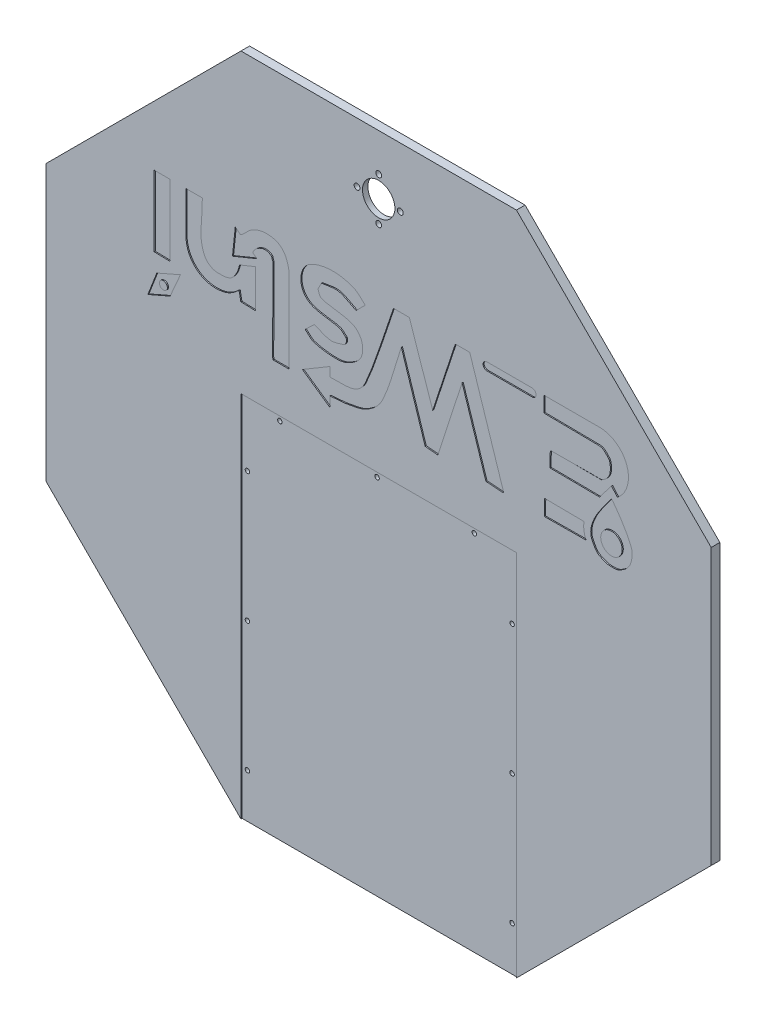
from build123d import *

# Parameters (mm, degrees)
BOSS_EXTRUDE1_DEPTH     = 8
SKETCH3_R               = 25
CUT_EXTRUDE1_DEPTH      = 3
SKETCH4_R               = 2.70323892
CUT_EXTRUDE2_DEPTH      = 192
SKETCH5_R               = 15
CUT_EXTRUDE3_DEPTH      = 192
ESQUISSE2_W             = 255
ESQUISSE2_H             = 341
ENL_V_MAT_EXTRU_2_DEPTH = 1
ESQUISSE5_R             = 3.714022147
ESQUISSE5_R_2           = 9.95215408
ENL_V_MAT_EXTRU_4_DEPTH = 1
ESQUISSE8_R             = 2.05
ENL_V_MAT_EXTRU_5_DEPTH = 20


with BuildPart() as part:
    # Sketch1 → Boss-Extrude1 (new body)
    with BuildSketch(Plane.XY):
        Polygon((307.812229203, -127.5), (307.812229203, 127.5), (127.5, 307.812229203), (-127.5, 307.812229203), (-307.812229203, 127.5), (-307.812229203, -127.5), (-127.5, -307.812229203), (127.5, -307.812229203), align=None)
    extrude(amount=BOSS_EXTRUDE1_DEPTH)

    # Sketch3 → Cut-Extrude1 (cut)
    with BuildSketch(Plane(origin=(0, 0, 0), x_dir=(-1, 0, 0), z_dir=(0, 0, -1))):
        with Locations((0.000533906, 252.812229203)):
            Circle(SKETCH3_R)
    extrude(amount=-CUT_EXTRUDE1_DEPTH, mode=Mode.SUBTRACT)

    # Sketch4 → Cut-Extrude2 (cut)
    with BuildSketch(Plane(origin=(0, 0, 3), x_dir=(-1, 0, 0), z_dir=(0, 0, -1))):
        with Locations((0.000533906, 272.812229203)):
            Circle(SKETCH4_R)
        with Locations((20.000533906, 252.812229203)):
            Circle(SKETCH4_R)
        with Locations((0.000533906, 232.812229203)):
            Circle(SKETCH4_R)
        with Locations((-19.999466094, 252.812229203)):
            Circle(SKETCH4_R)
    extrude(amount=-CUT_EXTRUDE2_DEPTH, mode=Mode.SUBTRACT)

    # Sketch5 → Cut-Extrude3 (cut)
    with BuildSketch(Plane(origin=(0, 0, 3), x_dir=(-1, 0, 0), z_dir=(0, 0, -1))):
        with Locations((0.000533906, 252.812229203)):
            Circle(SKETCH5_R)
    extrude(amount=-CUT_EXTRUDE3_DEPTH, mode=Mode.SUBTRACT)

    # Esquisse2 → Enlèv. mat.-Extru.2 (cut)
    with BuildSketch(Plane.XY.offset(8)):
        with Locations((0, -137.312229203)):
            Rectangle(ESQUISSE2_W, ESQUISSE2_H)
    extrude(amount=-ENL_V_MAT_EXTRU_2_DEPTH, mode=Mode.SUBTRACT)

    # Esquisse5 → Enlèv. mat.-Extru.4 (cut)
    # profile 1 of 10: a face of its own
    with BuildSketch(Plane.XY.offset(8)):
        with BuildLine():
            Line((-45.230159816, 63.295459959), (-70.603176298, 80.946254034))
            Line((-70.603176298, 80.946254034), (-45.230159816, 96.022973973))
            Line((-45.230159816, 96.022973973), (-45.230159816, 87.639650484))
            add(Edge.make_bspline(
                [(-45.230159816, 87.639650484), (-37.629744661, 88.242930126), (-29.590515935, 86.833821312), (-22.42891435, 89.449489411), (-17.869764982, 91.114650676), (-14.063440889, 95.285285777), (-12.119626791, 99.732778526), (-1.856796823, 123.214376856), (5.101826312, 148.005608455), (13.712552863, 172.142023419)],
                knots=[0, 0, 0, 0, 1, 1, 1, 2, 2, 2, 3, 3, 3, 3], degree=3))
            Line((13.712552863, 172.142023419), (28.369904623, 172.142023419))
            Line((28.369904623, 172.142023419), (50.010583211, 108.525619775))
            Line((50.010583211, 108.525619775), (70.970901175, 172.142023419))
            Line((70.970901175, 172.142023419), (84.284504135, 172.142023419))
            Line((84.284504135, 172.142023419), (115.833336114, 75.062656009))
            Line((115.833336114, 75.062656009), (99.28571667, 76.165830639))
            Line((99.28571667, 76.165830639), (77.222224076, 144.194932801))
            Line((77.222224076, 144.194932801), (54.791006607, 75.062656009))
            Line((54.791006607, 75.062656009), (43.023810557, 76.165830639))
            Line((43.023810557, 76.165830639), (20.960317964, 144.562657678))
            add(Edge.make_bspline(
                [(20.960317964, 144.562657678), (15.076719939, 127.402163439), (11.201479707, 109.415688165), (3.309523889, 93.08117496), (0.443884591, 87.149968041), (-4.99293271, 82.458727525), (-10.66402142, 79.107629651), (-16.143355622, 75.869841259), (-22.799375818, 75.156460206), (-29.050265248, 73.959481379), (-34.369164688, 72.940968721), (-39.836861627, 72.978881709), (-45.230159816, 72.488581873)],
                knots=[0, 0, 0, 0, 1, 1, 1, 2, 2, 2, 3, 3, 3, 4, 4, 4, 4], degree=3))
            Line((-45.230159816, 72.488581873), (-45.230159816, 63.295459959))
        make_face()
    # profile 2 of 10: a face of its own
    with BuildSketch(Plane.XY.offset(8)):
        with BuildLine():
            Line((191.952385561, 75.430380886), (153.341273523, 75.062656009))
            Line((153.341273523, 75.062656009), (153.708998399, 89.771651071))
            Line((153.708998399, 89.771651071), (190.113761178, 89.403926195))
            add(Edge.make_bspline(
                [(190.113761178, 89.403926195), (188.907704828, 82.118702452), (191.952385561, 75.430380886)],
                knots=[0, 0, 0, 1, 1, 1], degree=2))
        make_face()
    # profile 3 of 10: a face of its own
    with BuildSketch(Plane.XY.offset(8)):
        Polygon((-213.648153278, 69.546782861), (-193.055560191, 78.519082092), (-183.4947134, 100.435672491), (-205.367788327, 90.905460705), align=None)
        with Locations((-199.294839212, 84.052843866)):
            Circle(ESQUISSE5_R, mode=Mode.SUBTRACT)
    # profile 4 of 10: a face of its own
    with BuildSketch(Plane.XY.offset(8)):
        with BuildLine():
            Line((-116.591484481, 151.634860994), (-112.891537102, 148.60763132))
            Line((-112.891537102, 148.60763132), (-135.322754572, 139.414509406))
            Line((-135.322754572, 139.414509406), (-132.748680436, 164.052076135))
            Line((-132.748680436, 164.052076135), (-127.968257041, 160.37482737))
            add(Edge.make_bspline(
                [(-127.968257041, 160.37482737), (-124.848176224, 161.622859696), (-121.07428403, 167.550410427), (-116.568785868, 169.93567416), (-112.979004932, 171.83614642), (-108.878093389, 173.117807312), (-104.801589818, 173.245198049), (-91.414647248, 173.663540004), (-85.267867802, 167.095778675), (-83.105822101, 154.123504468)],
                knots=[0, 0, 0, 0, 1, 1, 1, 2, 2, 2, 3, 3, 3, 3], degree=3))
            Line((-83.105822101, 154.123504468), (-83.105822101, 75.062656009))
            Line((-83.105822101, 75.062656009), (-97.814817163, 75.062656009))
            add(Edge.make_bspline(
                [(-97.814817163, 75.062656009), (-97.934075185, 75.798650903), (-98.172468606, 76.525046335), (-98.172591228, 77.270640691), (-98.176784271, 102.766231788), (-97.820716117, 128.261047225), (-97.827759295, 153.756637693), (-97.827807183, 153.929984856), (-98.133688709, 153.963433907), (-98.193822589, 154.126016678), (-98.503380682, 154.962962719), (-98.608101854, 155.866434305), (-98.917659947, 156.703380346), (-99.218329346, 157.516294203), (-100.018850077, 158.081654092), (-100.747976415, 158.550275272), (-106.054300251, 161.960734621), (-114.69643112, 157.235724024), (-116.591484481, 151.634860994)],
                knots=[0, 0, 0, 0, 1, 1, 1, 2, 2, 2, 3, 3, 3, 4, 4, 4, 5, 5, 5, 6, 6, 6, 6], degree=3))
        make_face()
    # profile 5 of 10: a face of its own
    with BuildSketch(Plane.XY.offset(8)):
        with BuildLine():
            Line((-68.029102162, 114.4092178), (-59.571430002, 122.499165085))
            add(Edge.make_bspline(
                [(-59.571430002, 122.499165085), (-54.545856689, 120.783115661), (-49.781590282, 117.851127104), (-44.494710063, 117.351016813), (-40.378111997, 116.961608888), (-36.404762779, 119.067066237), (-32.359789137, 119.925090949)],
                knots=[0, 0, 0, 0, 1, 1, 1, 2, 2, 2, 2], degree=3))
            add(Edge.make_bspline(
                [(-32.359789137, 119.925090949), (-28.837222901, 122.339623633), (-30.153439877, 126.544138727)],
                knots=[0, 0, 0, 1, 1, 1], degree=2))
            add(Edge.make_bspline(
                [(-30.153439877, 126.544138727), (-32.237214178, 128.137613192), (-33.907682487, 130.520904097), (-36.404762779, 131.324562122), (-44.757843973, 134.012910092), (-54.102271917, 133.332216961), (-62.145504138, 136.84043527), (-66.120949941, 138.574406312), (-69.504084332, 142.31970476), (-70.970901175, 146.401282061), (-72.546724945, 150.786182986), (-72.261922638, 156.020618227), (-70.603176298, 160.37482737), (-69.12083244, 164.265979999), (-65.889342898, 167.74529094), (-62.145504138, 169.567949283), (-56.156619392, 172.483590541), (-49.316703485, 173.918399038), (-42.65608568, 173.980647802), (-35.901399349, 174.043775712), (-29.038803064, 172.522933482), (-22.798942346, 169.93567416), (-18.696099684, 168.234495495), (-15.934744651, 164.297226053), (-12.502645803, 161.478001999)],
                knots=[0, 0, 0, 0, 1, 1, 1, 2, 2, 2, 3, 3, 3, 4, 4, 4, 5, 5, 5, 6, 6, 6, 7, 7, 7, 8, 8, 8, 8], degree=3))
            Line((-12.502645803, 161.478001999), (-20.960317964, 153.020329838))
            add(Edge.make_bspline(
                [(-20.960317964, 153.020329838), (-26.353616153, 155.471829016), (-31.313611856, 159.303268625), (-37.140212532, 160.37482737), (-42.346381434, 161.332283719), (-47.681658993, 159.394227699), (-52.952382224, 158.903927863)],
                knots=[0, 0, 0, 0, 1, 1, 1, 2, 2, 2, 2], degree=3))
            Line((-52.952382224, 158.903927863), (-56.261906113, 152.652604962))
            add(Edge.make_bspline(
                [(-56.261906113, 152.652604962), (-55.158731483, 150.69140562), (-55.056292275, 147.567041784), (-52.952382224, 146.769006937), (-43.803159978, 143.298612292), (-33.305061976, 144.274904285), (-24.269841853, 140.517684036), (-20.425077889, 138.918871299), (-17.224851463, 135.241543397), (-15.812169692, 131.324562122), (-14.314515919, 127.171976661), (-14.393178666, 122.123121012), (-16.179894568, 118.086466566), (-17.969363502, 114.043592309), (-21.938265595, 111.149050614), (-25.740741359, 108.893344652), (-29.375861205, 106.736917625), (-33.650024375, 105.30696982), (-37.875662285, 105.216095886), (-45.29353002, 105.056571849), (-52.842082778, 105.994153405), (-59.939154878, 108.157894899), (-63.198956953, 109.151736995), (-65.332453068, 112.3254435), (-68.029102162, 114.4092178)],
                knots=[0, 0, 0, 0, 1, 1, 1, 2, 2, 2, 3, 3, 3, 4, 4, 4, 5, 5, 5, 6, 6, 6, 7, 7, 7, 8, 8, 8, 8], degree=3))
        make_face()
    # profile 6 of 10: a face of its own
    with BuildSketch(Plane.XY.offset(8)):
        with BuildLine():
            Line((-163.26984519, 172.142023419), (-178.346565129, 172.142023419))
            add(Edge.make_bspline(
                [(-129.131634858, 114.725284533), (-130.822980357, 114.163473373), (-131.7323915, 112.943083109), (-133.179692227, 111.787730324), (-136.365643107, 109.244446019), (-139.860965042, 107.500998876), (-143.849108196, 106.650771463), (-162.145908631, 102.750098719), (-178.092833146, 114.748110517), (-178.386682513, 133.898657299), (-178.582263915, 146.64495259), (-178.35993759, 159.394234713), (-178.346565129, 172.142023419)],
                knots=[0, 0, 0, 0, 1, 1, 1, 2, 2, 2, 3, 3, 3, 4, 4, 4, 4], degree=3))
            Line((-129.131634858, 114.725284533), (-127.600532164, 106.686995393))
            Line((-127.600532164, 106.686995393), (-113.994711732, 106.319270516))
            Line((-113.994711732, 106.319270516), (-113.994711732, 141.620858665))
            Line((-113.994711732, 141.620858665), (-128.703706794, 135.73726064))
            add(Edge.make_bspline(
                [(-163.26984519, 172.142023419), (-163.069582875, 149.91290646), (-167.107256831, 142.538259503), (-161.798945684, 128.382763109), (-159.798563561, 123.048410782), (-154.4319245, 119.189641196), (-148.560850128, 119.189641196), (-144.885216524, 119.189641196), (-138.852452686, 119.23296474), (-135.690479448, 122.131440208), (-131.677534931, 125.809972682), (-129.978935673, 130.636345124), (-128.703706794, 135.73726064)],
                knots=[0, 0, 0, 0, 1, 1, 1, 2, 2, 2, 3, 3, 3, 4, 4, 4, 4], degree=3))
        make_face()
    # profile 7 of 10: a face of its own
    with BuildSketch(Plane.XY.offset(8)):
        Polygon((-193.055560191, 106.319270516), (-207.764555253, 106.686995393), (-207.764555253, 172.142023419), (-193.055560191, 172.142023419), align=None)
    # profile 8 of 10: a face of its own
    with BuildSketch(Plane.XY.offset(8)):
        with BuildLine():
            Line((204.455031364, 116.247842183), (158.489421795, 116.61556706))
            Line((158.489421795, 116.61556706), (158.857146671, 130.589112369))
            add(Edge.make_bspline(
                [(158.857146671, 130.589112369), (159.592596424, 130.711687328), (160.317923965, 130.951057618), (161.063495931, 130.956837245), (176.13976289, 131.073707532), (191.217426052, 130.835254748), (206.293655747, 130.956837245), (206.466997279, 130.958235161), (206.506334202, 131.247038911), (206.661380623, 131.324562122), (210.987822985, 133.487783303), (214.20599965, 136.838085487), (214.383603031, 141.988583542), (214.458547835, 144.161982852), (214.748973314, 149.345435667), (212.544978648, 151.549430332), (211.296262955, 152.798146026), (208.15205324, 156.795111059), (205.558205994, 157.065303481), (200.680069869, 157.57344266), (195.753261619, 157.364440236), (190.849210931, 157.433028357), (178.224629838, 157.609595925), (165.598769408, 157.678178275), (152.973548646, 157.800753234)],
                knots=[0, 0, 0, 0, 1, 1, 1, 2, 2, 2, 3, 3, 3, 4, 4, 4, 5, 5, 5, 6, 6, 6, 7, 7, 7, 8, 8, 8, 8], degree=3))
            Line((152.973548646, 157.800753234), (152.973548646, 172.142023419))
            Line((152.973548646, 172.142023419), (204.455031364, 172.142023419))
            ThreePointArc((204.455031364, 172.142023419), (229.748649596, 154.13137862), (221.002650809, 124.337789467))
            Line((221.002650809, 124.337789467), (215.486777661, 130.589112369))
            Line((215.486777661, 130.589112369), (204.455031364, 116.247842183))
        make_face()
    # profile 9 of 10: a face of its own
    with BuildSketch(Plane.XY.offset(8)):
        with BuildLine():
            Line((100.208047432, 172.46961034), (142.071556424, 172.46961034))
            ThreePointArc((142.071556424, 172.46961034), (145.689435815, 168.851730949), (142.071556424, 165.233851558))
            Line((142.071556424, 165.233851558), (100.208047432, 165.233851558))
            ThreePointArc((100.208047432, 165.233851558), (96.590168041, 168.851730949), (100.208047432, 172.46961034))
        make_face()
    # profile 10 of 10: a face of its own
    with BuildSketch(Plane.XY.offset(8)):
        with BuildLine():
            add(Edge.make_bspline(
                [(210.338629389, 66.604983848), (206.930788063, 68.024917734), (206.498713468, 67.958707514), (203.719581611, 69.546782861), (202.421513801, 70.288535895), (200.808581271, 72.198577547), (200.042332845, 73.591756503), (198.506482401, 76.384211856), (196.653616879, 79.243292751), (196.36508408, 82.41715354), (195.202290409, 95.207883918), (208.429289977, 110.412333068), (215.486777661, 120.292815825)],
                knots=[4, 4, 4, 4, 5, 5, 5, 6, 6, 6, 7, 7, 7, 8, 8, 8, 8], degree=3))
            add(Edge.make_bspline(
                [(215.486777661, 120.292815825), (220.210915335, 115.568678151), (234.608471241, 93.492424718), (234.608471241, 86.829852059), (234.608471241, 79.991993074), (233.360015755, 74.14274144), (227.621698587, 69.914507737), (225.740337289, 68.528241518), (221.75655416, 65.869534095), (219.164026426, 65.869534095), (216.212030506, 65.869534095), (213.0635487, 65.469600802), (210.338629389, 66.604983848)],
                knots=[0, 0, 0, 0, 1, 1, 1, 2, 2, 2, 3, 3, 3, 4, 4, 4, 4], degree=3))
        make_face()
        with Locations((215.486777661, 84.44958065)):
            Circle(ESQUISSE5_R_2, mode=Mode.SUBTRACT)
    extrude(amount=-ENL_V_MAT_EXTRU_4_DEPTH, mode=Mode.SUBTRACT)

    # Esquisse8 → Enlèv. mat.-Extru.5 (cut)
    with BuildSketch(Plane.XY.offset(7)):
        with Locations((-92.5, 28.187770797)):
            Circle(ESQUISSE8_R)
        with Locations((-2.5, 28.187770797)):
            Circle(ESQUISSE8_R)
        with Locations((87.5, 28.187770797)):
            Circle(ESQUISSE8_R)
        with Locations((122.5, -26.812229203)):
            Circle(ESQUISSE8_R)
        with Locations((122.5, -146.812229203)):
            Circle(ESQUISSE8_R)
        with Locations((122.5, -266.812229203)):
            Circle(ESQUISSE8_R)
        with Locations((-122.5, -266.812229203)):
            Circle(ESQUISSE8_R)
        with Locations((-122.5, -146.812229203)):
            Circle(ESQUISSE8_R)
        with Locations((-122.5, -26.812229203)):
            Circle(ESQUISSE8_R)
    extrude(amount=-ENL_V_MAT_EXTRU_5_DEPTH, mode=Mode.SUBTRACT)


solid = part.part
